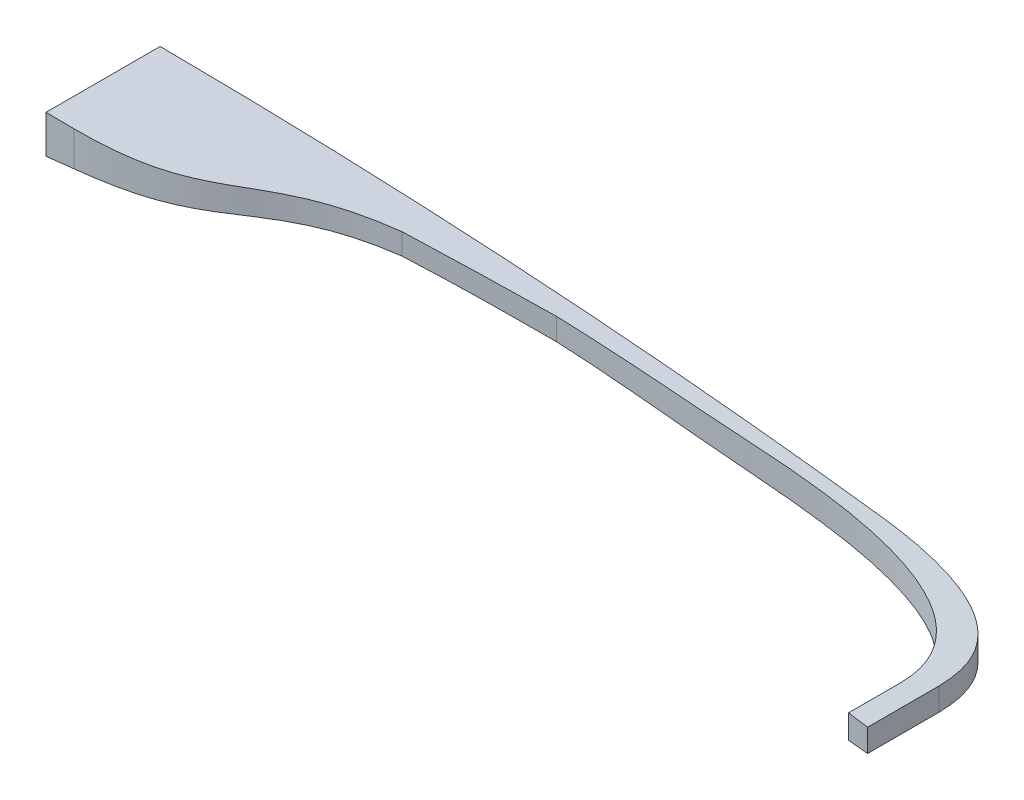
from build123d import *

# Parameters (mm, degrees)
SKETCH1_W           = 146.05
SKETCH1_H           = 19.05
BOSS_EXTRUDE1_DEPTH = 15.24
CUT_EXTRUDE2_DEPTH  = 19.05
CUT_EXTRUDE3_DEPTH  = 149.073504166
SKETCH5_W           = 6.35
SKETCH5_H           = 3.81
CUT_EXTRUDE4_DEPTH  = 5.08
BOSS_EXTRUDE2_DEPTH = 8.89


with BuildPart() as part:
    # Sketch1 → Boss-Extrude1 (new body)
    with BuildSketch(Plane(origin=(0, 0, 0), x_dir=(1, 0, 0), z_dir=(0, 1, 0))):
        with Locations((73.025, 9.525)):
            Rectangle(SKETCH1_W, SKETCH1_H)
    extrude(amount=BOSS_EXTRUDE1_DEPTH)

    # Sketch4 → Cut-Extrude2 (cut)
    with BuildSketch(Plane(origin=(0, 15.24, 0), x_dir=(1, 0, 0), z_dir=(0, 1, 0))):
        with BuildLine():
            add(Edge.make_bspline(
                [(4.646347869, 0), (27.146548215, 0.082392024), (24.692683865, 9.912388059), (45.7201241, 13.713148425)],
                knots=[0, 0, 0, 0, 0.354962546, 0.354962546, 0.354962546, 0.354962546], degree=3))
            Line((4.646347869, 0), (142.875, 0))
            add(Edge.make_bspline(
                [(69.391440705, 15.814171824), (77.407984115, 16.125047145), (89.853629785, 16.2269087), (108.044166199, 16.682225268), (142.597599885, 19.01108954), (142.875, 0)],
                knots=[0.464805359, 0.464805359, 0.464805359, 0.464805359, 0.569522495, 0.63402624, 1, 1, 1, 1], degree=3))
            Line((69.391440705, 15.814171824), (45.7201241, 13.713148425))
        make_face()
        with BuildLine():
            add(Edge.make_bspline(
                [(120.855562162, 19.05), (143.761651025, 18.977988367), (145.894119739, 9.922730541), (146.05, 3.057021482)],
                knots=[0, 0, 0, 0, 0.863105696, 0.863105696, 0.863105696, 0.863105696], degree=3))
            Line((146.05, 3.057021482), (146.05, 19.05))
            Line((146.05, 19.05), (120.855562162, 19.05))
        make_face()
    extrude(amount=-CUT_EXTRUDE2_DEPTH, mode=Mode.SUBTRACT)

    # Sketch3 → Cut-Extrude3 (cut, through all)
    with BuildSketch(Plane(origin=(0, 0, -19.05), x_dir=(-1, 0, 0), z_dir=(0, 0, -1))):
        with BuildLine():
            Line((0, 0), (0, 8.89))
            add(Edge.make_bspline(
                [(0, 8.89), (-49.15708128, 14.835142216), (-97.484997273, 4.911633358), (-146.05, 0)],
                knots=[0, 0, 0, 0, 1, 1, 1, 1], degree=3))
            Line((-146.05, 0), (0, 0))
        make_face()
        with BuildLine():
            add(Edge.make_bspline(
                [(0, 15.24), (-48.867034278, 14.944686699), (-97.766141765, 11.393996233), (-146.05, 3.81)],
                knots=[0, 0, 0, 0, 1, 1, 1, 1], degree=3))
            Line((0, 15.24), (-146.05, 15.24))
            Line((-146.05, 15.24), (-146.05, 3.81))
        make_face()
    extrude(amount=-CUT_EXTRUDE3_DEPTH, mode=Mode.SUBTRACT)

    # Sketch5 → Cut-Extrude4 (cut)
    with BuildSketch(Plane.ZY):
        with Locations((-9.525, 10.795)):
            Rectangle(SKETCH5_W, SKETCH5_H)
    extrude(amount=-CUT_EXTRUDE4_DEPTH, mode=Mode.SUBTRACT)

    # Sketch7 → Boss-Extrude2 (add)
    with BuildSketch(Plane.XY):
        with BuildLine():
            add(Edge.make_bspline(
                [(146.05, 0), (145.256073372, 0.080293963), (144.462266504, 0.161772098), (143.668576555, 0.244379923), (142.875, 0.328063112)],
                knots=[0, 0, 0, 0, 0, 1, 1, 1, 1, 1], degree=4))
            Line((146.05, 0), (146.05, 3.81))
            add(Edge.make_bspline(
                [(146.05, 3.81), (145.256475872, 3.934639667), (144.462799753, 4.058311672), (143.668973763, 4.181017973), (142.875, 4.302760535)],
                knots=[0, 0, 0, 0, 0, 1, 1, 1, 1, 1], degree=4))
            Line((142.875, 4.302760535), (142.875, 0.328063112))
        make_face()
    extrude(amount=BOSS_EXTRUDE2_DEPTH)


solid = part.part
